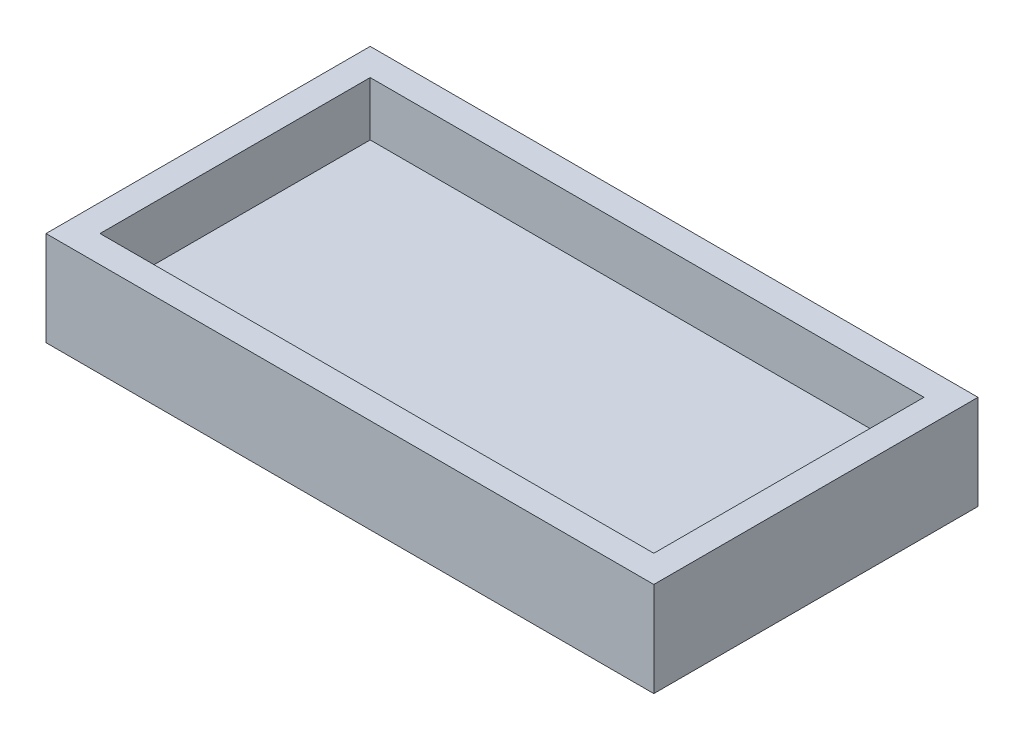
from build123d import *

# Parameters (mm, degrees)
SKETCH1_W           = 41
SKETCH1_H           = 20
BOSS_EXTRUDE1_DEPTH = 3
SKETCH2_W           = 45
SKETCH2_H           = 24
SKETCH2_W_2         = 41
SKETCH2_H_2         = 20
BOSS_EXTRUDE2_DEPTH = 7


with BuildPart() as part:
    # Sketch1 → Boss-Extrude1 (new body)
    with BuildSketch(Plane(origin=(0, 0, 0), x_dir=(1, 0, 0), z_dir=(0, 1, 0))):
        Rectangle(SKETCH1_W, SKETCH1_H)
    extrude(amount=BOSS_EXTRUDE1_DEPTH)

    # Sketch2 → Boss-Extrude2 (add)
    with BuildSketch(Plane.XZ):
        Rectangle(SKETCH2_W, SKETCH2_H)
        Rectangle(SKETCH2_W_2, SKETCH2_H_2, mode=Mode.SUBTRACT)
    extrude(amount=-BOSS_EXTRUDE2_DEPTH)


solid = part.part
